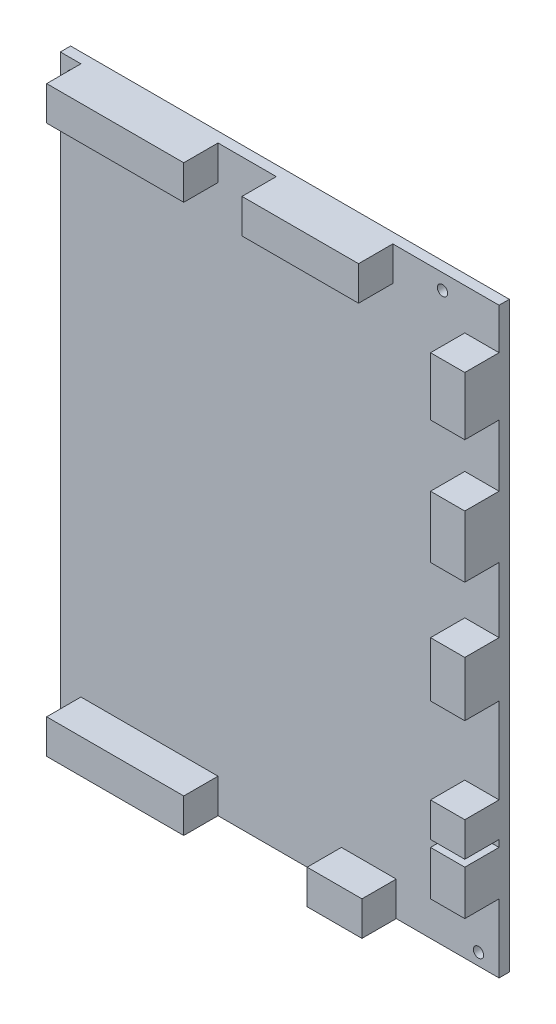
from build123d import *

# Parameters (mm, degrees)
SKETCH_1_W      = 128
SKETCH_1_H      = 170
SKETCH_1_R      = 1.5
EXTRUDE_1_DEPTH = 3
SKETCH_2_W      = 40
SKETCH_2_H      = 10
SKETCH_2_W_2    = 16
SKETCH_2_W_3    = 10
SKETCH_2_H_2    = 13
SKETCH_2_H_3    = 16
SKETCH_2_H_4    = 18
SKETCH_2_H_5    = 17
SKETCH_2_W_4    = 34
EXTRUDE_2_DEPTH = 10


with BuildPart() as part:
    # 草圖1 → 填料-伸長1 (new body)
    with BuildSketch(Plane.XY):
        with Locations((15.018050542, -31.628158845)):
            Rectangle(SKETCH_1_W, SKETCH_1_H)
        with Locations((-45.481949458, 48.871841155)):
            Circle(SKETCH_1_R, mode=Mode.SUBTRACT)
        with Locations((-45.481949458, -112.128158845)):
            Circle(SKETCH_1_R, mode=Mode.SUBTRACT)
        with Locations((73.018050542, -113.128158845)):
            Circle(SKETCH_1_R, mode=Mode.SUBTRACT)
        with Locations((62.518050542, 48.871841155)):
            Circle(SKETCH_1_R, mode=Mode.SUBTRACT)
    extrude(amount=EXTRUDE_1_DEPTH)

    # 草圖2 → 填料-伸長2 (add)
    with BuildSketch(Plane.XY.offset(3)):
        with Locations((-22.981949458, -111.628158845)):
            Rectangle(SKETCH_2_W, SKETCH_2_H)
        with Locations((41.018050542, -111.628158845)):
            Rectangle(SKETCH_2_W_2, SKETCH_2_H)
        with Locations((74.018050542, -90.128158845)):
            Rectangle(SKETCH_2_W_3, SKETCH_2_H_2)
        with Locations((74.018050542, -76.628158845)):
            Rectangle(SKETCH_2_W_3, SKETCH_2_H)
        with Locations((74.018050542, -38.628158845)):
            Rectangle(SKETCH_2_W_3, SKETCH_2_H_3)
        with Locations((74.018050542, -2.628158845)):
            Rectangle(SKETCH_2_W_3, SKETCH_2_H_4)
        with Locations((74.018050542, 32.871841155)):
            Rectangle(SKETCH_2_W_3, SKETCH_2_H_5)
        with Locations((31.018050542, 48.371841155)):
            Rectangle(SKETCH_2_W_4, SKETCH_2_H)
        with Locations((-22.981949458, 48.371841155)):
            Rectangle(SKETCH_2_W, SKETCH_2_H)
    extrude(amount=EXTRUDE_2_DEPTH)


solid = part.part
